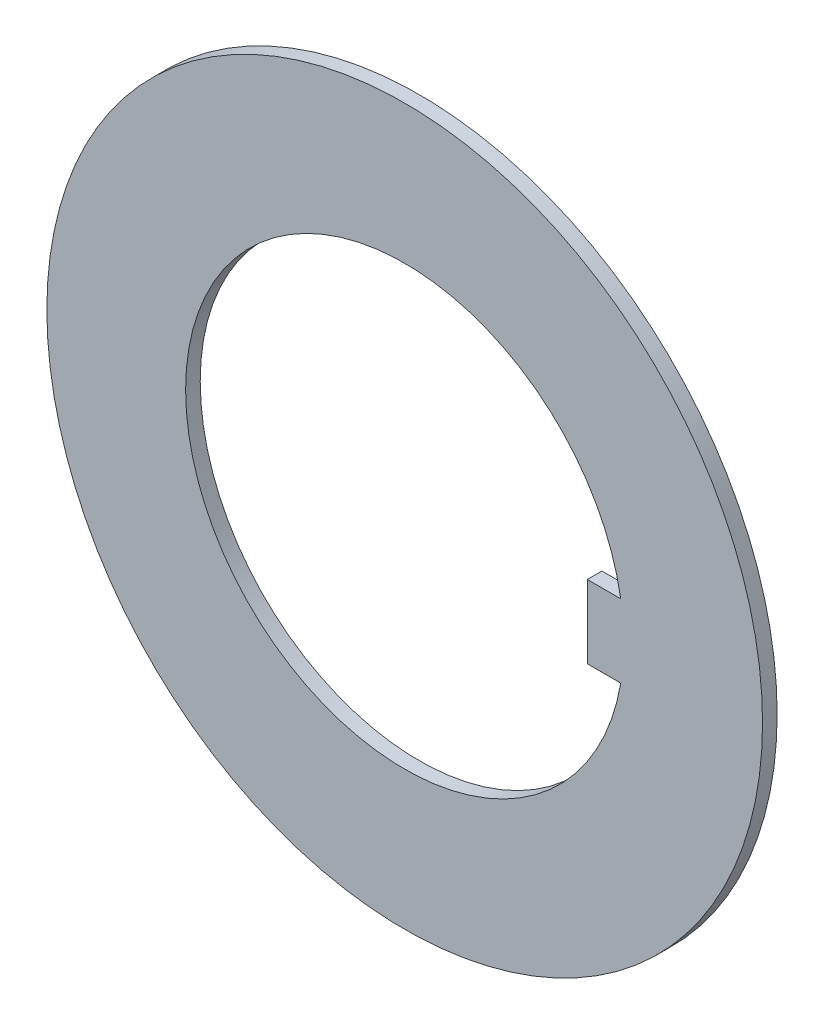
from build123d import *

# Parameters (mm, degrees)
SKETCH1_W                    = 9.5
SKETCH1_H                    = 1
SKETCH2_W                    = 2.7
SKETCH2_H                    = 1
EX_INNER_TAB_5MM_M27_5_DEPTH = 2.5


with BuildPart() as part:
    # Sketch1 → REV_MB6_30x49x1 (revolve)
    with BuildSketch(Plane(origin=(0, 0, 0), x_dir=(1, 0, 0), z_dir=(0, 1, 0))):
        with Locations((19.75, 88.5)):
            Rectangle(SKETCH1_W, SKETCH1_H)
    revolve(axis=Axis((0, 0, 150), (0, 0, -1)))

    # Sketch2 → EX_Inner_Tab_5mm_M27.5 (add, symmetric)
    with BuildSketch(Plane(origin=(0, 0, 0), x_dir=(1, 0, 0), z_dir=(0, 1, 0))):
        with Locations((13.85, 88.5)):
            Rectangle(SKETCH2_W, SKETCH2_H)
    extrude(amount=EX_INNER_TAB_5MM_M27_5_DEPTH, both=True)


solid = part.part
